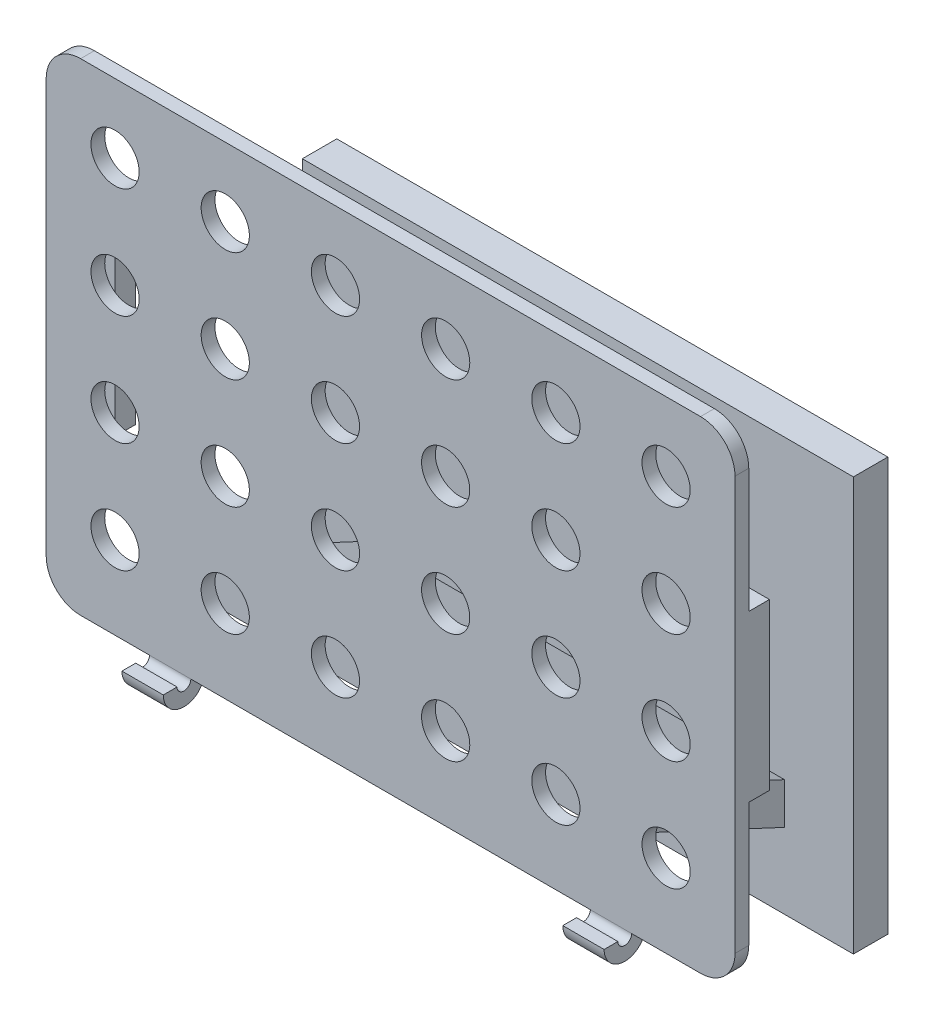
from build123d import *

# Parameters (mm, degrees)
BOSS_EXTRUDE1_DEPTH      = 10
SKETCH2_W                = 30
SKETCH2_H                = 10
SKETCH6_W                = 15
SKETCH6_H                = 120
BOSS_EXTRUDE2_DEPTH      = 40
SKETCH7_W                = 300
SKETCH7_H                = 30
BOSS_EXTRUDE3_DEPTH      = 10
BOSS_EXTRUDE3_DEPTH_BACK = 15
SKETCH10_W               = 400
SKETCH10_H               = 300
SKETCH11_R               = 17.5
CUT_EXTRUDE1_DEPTH       = 10
LPATTERN1_COUNT          = 3
LPATTERN1_PITCH          = 80
LPATTERN1_COUNT_DIR2     = 4
LPATTERN1_PITCH_DIR2     = 80
MIRROR1_COPY_1_SKETCH_R  = 17.5
MIRROR1_COPY_1_DEPTH     = 10
MIRROR1_COPY_2_SKETCH_R  = 17.5
MIRROR1_COPY_2_DEPTH     = 10
MIRROR1_COPY_3_SKETCH_R  = 17.5
MIRROR1_COPY_3_DEPTH     = 10
MIRROR1_COPY_4_SKETCH_R  = 17.5
MIRROR1_COPY_4_DEPTH     = 10
MIRROR1_COPY_5_SKETCH_R  = 17.5
MIRROR1_COPY_5_DEPTH     = 10
MIRROR1_COPY_6_SKETCH_R  = 17.5
MIRROR1_COPY_6_DEPTH     = 10
MIRROR1_COPY_7_SKETCH_R  = 17.5
MIRROR1_COPY_7_DEPTH     = 10
MIRROR1_COPY_8_SKETCH_R  = 17.5
MIRROR1_COPY_8_DEPTH     = 10
MIRROR1_COPY_9_SKETCH_R  = 17.5
MIRROR1_COPY_9_DEPTH     = 10
MIRROR1_COPY_10_SKETCH_R = 17.5
MIRROR1_COPY_10_DEPTH    = 10
MIRROR1_COPY_11_SKETCH_R = 17.5
MIRROR1_COPY_11_DEPTH    = 10


with BuildPart() as part:
    # Sketch1 → Boss-Extrude1 (new body)
    with BuildSketch(Plane.XY):
        with BuildLine():
            Line((-475, 350), (-25, 350))
            ThreePointArc((-25, 350), (-7.32233047, 342.67766953), (0, 325))
            Line((0, 325), (0, 25))
            ThreePointArc((0, 25), (-7.32233047, 7.32233047), (-25, 0))
            Line((-25, 0), (-475, 0))
            ThreePointArc((-475, 0), (-492.67766953, 7.32233047), (-500, 25))
            Line((-500, 25), (-500, 325))
            ThreePointArc((-500, 325), (-492.67766953, 342.67766953), (-475, 350))
        make_face()
    extrude(amount=BOSS_EXTRUDE1_DEPTH)

    # Sweep1: sweep along a path in Sketch3
    with BuildLine(Plane.ZY.offset(410)) as sweep1_path:
        ThreePointArc((5, 0), (15, -10), (25, 0))
    # Sketch2 → Sweep1 (sweep)
    with BuildSketch(Plane.XZ):
        with Locations((-410, 5)):
            Rectangle(SKETCH2_W, SKETCH2_H)
    sweep1 = sweep(path=sweep1_path.line)

    # Sketch6 → Boss-Extrude2 (add)
    with BuildSketch(Plane.ZY.offset(500)):
        with Locations((-7.5, 175)):
            Rectangle(SKETCH6_W, SKETCH6_H)
    boss_extrude2 = extrude(amount=-BOSS_EXTRUDE2_DEPTH)

    # Sweep2: sweep along a path in Sketch8
    with BuildLine(Plane.ZY.offset(250)) as sweep2_path:
        Line((0, 45.401266602), (-135.946168055, -17.991472659))
    # Sketch7 → Sweep2 (sweep)
    with BuildSketch(Plane(origin=(0, 0, 0), x_dir=(-1, 0, 0), z_dir=(0, 0, -1))):
        with Locations((250, 60)):
            Rectangle(SKETCH7_W, SKETCH7_H)
    sweep(path=sweep2_path.line)

    # Sketch10 → Boss-Extrude3 (add, two sides: drawn at the far end of the back side and taken through both)
    with BuildSketch(Plane(origin=(-400, -18.392739261, -135.946168055), x_dir=(1, 0, 0), z_dir=(0, 0, 1)).offset(-BOSS_EXTRUDE3_DEPTH_BACK)):
        with Locations((150, 100)):
            Rectangle(SKETCH10_W, SKETCH10_H)
    extrude(amount=BOSS_EXTRUDE3_DEPTH + BOSS_EXTRUDE3_DEPTH_BACK)

    # Sketch11 → Cut-Extrude1 (cut)
    with BuildSketch(Plane.XY.offset(10)):
        with Locations((-450, 300)):
            Circle(SKETCH11_R)
    cut_extrude1 = extrude(amount=-CUT_EXTRUDE1_DEPTH, mode=Mode.SUBTRACT)

    # LPattern1: Cut-Extrude1 3 × 4
    with Locations(*[(i * LPATTERN1_PITCH, -j * LPATTERN1_PITCH_DIR2, 0) for i in range(LPATTERN1_COUNT) for j in range(LPATTERN1_COUNT_DIR2) if (i, j) != (0, 0)]):
        add(cut_extrude1, mode=Mode.SUBTRACT)

    # Mirror1: Sweep1, Boss-Extrude2, Cut-Extrude1 across plane
    add(sweep1.mirror(Plane.ZY.offset(250)))
    add(boss_extrude2.mirror(Plane.ZY.offset(250)))
    add(cut_extrude1.mirror(Plane.ZY.offset(250)), mode=Mode.SUBTRACT)

    # Mirror1 copy 1 sketch → Mirror1 copy 1 (cut)
    with BuildSketch(Plane(origin=(-500, -80, 10), x_dir=(-1, 0, 0), z_dir=(0, 0, 1))):
        with Locations((-450, -300)):
            Circle(MIRROR1_COPY_1_SKETCH_R)
    extrude(amount=-MIRROR1_COPY_1_DEPTH, mode=Mode.SUBTRACT)

    # Mirror1 copy 2 sketch → Mirror1 copy 2 (cut)
    with BuildSketch(Plane(origin=(-500, -160, 10), x_dir=(-1, 0, 0), z_dir=(0, 0, 1))):
        with Locations((-450, -300)):
            Circle(MIRROR1_COPY_2_SKETCH_R)
    extrude(amount=-MIRROR1_COPY_2_DEPTH, mode=Mode.SUBTRACT)

    # Mirror1 copy 3 sketch → Mirror1 copy 3 (cut)
    with BuildSketch(Plane(origin=(-500, -240, 10), x_dir=(-1, 0, 0), z_dir=(0, 0, 1))):
        with Locations((-450, -300)):
            Circle(MIRROR1_COPY_3_SKETCH_R)
    extrude(amount=-MIRROR1_COPY_3_DEPTH, mode=Mode.SUBTRACT)

    # Mirror1 copy 4 sketch → Mirror1 copy 4 (cut)
    with BuildSketch(Plane(origin=(-580, 0, 10), x_dir=(-1, 0, 0), z_dir=(0, 0, 1))):
        with Locations((-450, -300)):
            Circle(MIRROR1_COPY_4_SKETCH_R)
    extrude(amount=-MIRROR1_COPY_4_DEPTH, mode=Mode.SUBTRACT)

    # Mirror1 copy 5 sketch → Mirror1 copy 5 (cut)
    with BuildSketch(Plane(origin=(-580, -80, 10), x_dir=(-1, 0, 0), z_dir=(0, 0, 1))):
        with Locations((-450, -300)):
            Circle(MIRROR1_COPY_5_SKETCH_R)
    extrude(amount=-MIRROR1_COPY_5_DEPTH, mode=Mode.SUBTRACT)

    # Mirror1 copy 6 sketch → Mirror1 copy 6 (cut)
    with BuildSketch(Plane(origin=(-580, -160, 10), x_dir=(-1, 0, 0), z_dir=(0, 0, 1))):
        with Locations((-450, -300)):
            Circle(MIRROR1_COPY_6_SKETCH_R)
    extrude(amount=-MIRROR1_COPY_6_DEPTH, mode=Mode.SUBTRACT)

    # Mirror1 copy 7 sketch → Mirror1 copy 7 (cut)
    with BuildSketch(Plane(origin=(-580, -240, 10), x_dir=(-1, 0, 0), z_dir=(0, 0, 1))):
        with Locations((-450, -300)):
            Circle(MIRROR1_COPY_7_SKETCH_R)
    extrude(amount=-MIRROR1_COPY_7_DEPTH, mode=Mode.SUBTRACT)

    # Mirror1 copy 8 sketch → Mirror1 copy 8 (cut)
    with BuildSketch(Plane(origin=(-660, 0, 10), x_dir=(-1, 0, 0), z_dir=(0, 0, 1))):
        with Locations((-450, -300)):
            Circle(MIRROR1_COPY_8_SKETCH_R)
    extrude(amount=-MIRROR1_COPY_8_DEPTH, mode=Mode.SUBTRACT)

    # Mirror1 copy 9 sketch → Mirror1 copy 9 (cut)
    with BuildSketch(Plane(origin=(-660, -80, 10), x_dir=(-1, 0, 0), z_dir=(0, 0, 1))):
        with Locations((-450, -300)):
            Circle(MIRROR1_COPY_9_SKETCH_R)
    extrude(amount=-MIRROR1_COPY_9_DEPTH, mode=Mode.SUBTRACT)

    # Mirror1 copy 10 sketch → Mirror1 copy 10 (cut)
    with BuildSketch(Plane(origin=(-660, -160, 10), x_dir=(-1, 0, 0), z_dir=(0, 0, 1))):
        with Locations((-450, -300)):
            Circle(MIRROR1_COPY_10_SKETCH_R)
    extrude(amount=-MIRROR1_COPY_10_DEPTH, mode=Mode.SUBTRACT)

    # Mirror1 copy 11 sketch → Mirror1 copy 11 (cut)
    with BuildSketch(Plane(origin=(-660, -240, 10), x_dir=(-1, 0, 0), z_dir=(0, 0, 1))):
        with Locations((-450, -300)):
            Circle(MIRROR1_COPY_11_SKETCH_R)
    extrude(amount=-MIRROR1_COPY_11_DEPTH, mode=Mode.SUBTRACT)


solid = part.part
